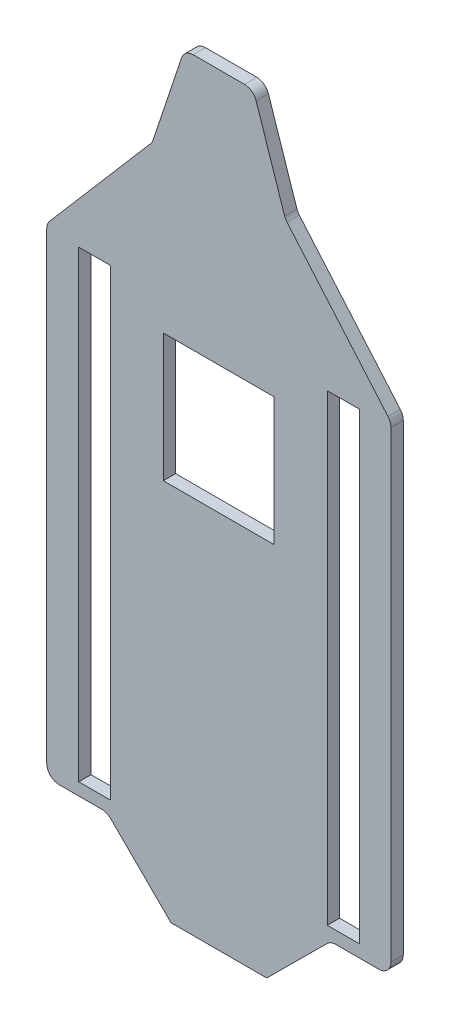
from build123d import *

# Parameters (mm, degrees)
SKETCH1_W           = 13
SKETCH1_H           = 188.148975749
BOSS_EXTRUDE1_DEPTH = 5
SKETCH2_W           = 45
SKETCH2_H           = 52
CUT_EXTRUDE1_DEPTH  = 341.122657523


with BuildPart() as part:
    # Sketch1 → Boss-Extrude1 (new body)
    with BuildSketch(Plane.XY):
        with BuildLine():
            Line((0, 30.859943174), (0, 219.008918923))
            ThreePointArc((0, 219.008918923), (0.311003468, 220.744808182), (1.205324608, 222.264750409))
            Line((1.205324608, 222.264750409), (42.261389271, 270.115641625))
            ThreePointArc((42.261389271, 270.115641625), (42.81710491, 270.906904614), (43.210130369, 271.790334282))
            Line((43.210130369, 271.790334282), (54.802396658, 306.567133147))
            ThreePointArc((54.802396658, 306.567133147), (56.605292439, 309.029920375), (59.503914938, 309.985818768))
            Line((59.503914938, 309.985818768), (80.378944352, 309.985818768))
            ThreePointArc((80.378944352, 309.985818768), (83.277566851, 309.029920375), (85.080462632, 306.567133147))
            Line((85.080462632, 306.567133147), (96.672728921, 271.790334282))
            ThreePointArc((96.672728921, 271.790334282), (97.06575438, 270.906904614), (97.621470019, 270.115641625))
            Line((97.621470019, 270.115641625), (138.677534682, 222.264750409))
            ThreePointArc((138.677534682, 222.264750409), (139.571855822, 220.744808182), (139.88285929, 219.008918923))
            Line((139.88285929, 219.008918923), (139.88285929, 30.859943174))
            ThreePointArc((139.88285929, 30.859943174), (138.418393196, 27.324409268), (134.88285929, 25.859943174))
            Line((134.88285929, 25.859943174), (117.446021446, 25.859943174))
            ThreePointArc((117.446021446, 25.859943174), (115.538843756, 25.481920377), (113.920048724, 24.405012478))
            Line((113.920048724, 24.405012478), (89.38285929, 0))
            Line((89.38285929, 0), (50.5, 0))
            Line((50.5, 0), (25.962810565, 24.405012478))
            ThreePointArc((25.962810565, 24.405012478), (24.344015534, 25.481920377), (22.436837844, 25.859943174))
            Line((22.436837844, 25.859943174), (5, 25.859943174))
            ThreePointArc((5, 25.859943174), (1.464466094, 27.324409268), (0, 30.859943174))
        make_face()
        with Locations((19.5, 124.934431049)):
            Rectangle(SKETCH1_W, SKETCH1_H, mode=Mode.SUBTRACT)
        with Locations((120.5, 124.934431049)):
            Rectangle(SKETCH1_W, SKETCH1_H, mode=Mode.SUBTRACT)
    extrude(amount=BOSS_EXTRUDE1_DEPTH)

    # Sketch2 → Cut-Extrude1 (cut, through all)
    with BuildSketch(Plane.XY.offset(5)):
        with Locations((69.88285929, 180.008918923)):
            Rectangle(SKETCH2_W, SKETCH2_H)
    extrude(amount=-CUT_EXTRUDE1_DEPTH, mode=Mode.SUBTRACT)


solid = part.part
